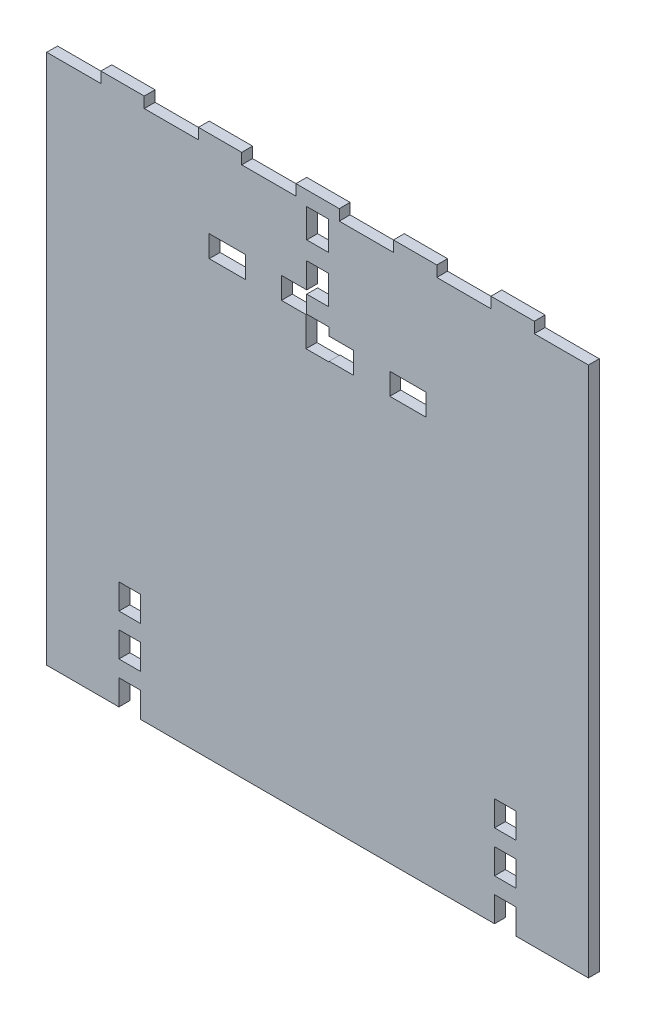
from build123d import *

# Parameters (mm, degrees)
ESQUISSE1_W              = 150
ESQUISSE1_H              = 150
BOSS_EXTRU_1_DEPTH       = 3
ESQUISSE12_W             = 6
ESQUISSE12_H             = 7
ENL_V_MAT_EXTRU_3_DEPTH  = 3
ESQUISSE14_W             = 15
ESQUISSE14_H             = 3
ENL_V_MAT_EXTRU_4_DEPTH  = 3
ESQUISSE15_W             = 10
ESQUISSE15_H             = 6
ESQUISSE15_W_2           = 6
ESQUISSE15_H_2           = 8
ESQUISSE15_W_3           = 7
ENL_V_MAT_EXTRU_9_DEPTH  = 10
ESQUISSE17_W             = 6.4
ESQUISSE17_H             = 8.4
ENL_V_MAT_EXTRU_12_DEPTH = 10


with BuildPart() as part:
    # Esquisse1 → Boss.-Extru.1 (new body)
    with BuildSketch(Plane.XY):
        with Locations((75, -75)):
            Rectangle(ESQUISSE1_W, ESQUISSE1_H)
    extrude(amount=BOSS_EXTRU_1_DEPTH)

    # Esquisse12 → Enlèv. mat.-Extru.3 (cut)
    with BuildSketch(Plane(origin=(0, 0, 0), x_dir=(-1, 0, 0), z_dir=(0, 0, -1))):
        with Locations((-127, -123.5)):
            Rectangle(ESQUISSE12_W, ESQUISSE12_H)
        with Locations((-127, -135)):
            Rectangle(ESQUISSE12_W, ESQUISSE12_H)
        with Locations((-127, -146.5)):
            Rectangle(ESQUISSE12_W, ESQUISSE12_H)
        with Locations((-23, -123.5)):
            Rectangle(ESQUISSE12_W, ESQUISSE12_H)
        with Locations((-23, -135)):
            Rectangle(ESQUISSE12_W, ESQUISSE12_H)
        with Locations((-23, -146.5)):
            Rectangle(ESQUISSE12_W, ESQUISSE12_H)
    extrude(amount=-ENL_V_MAT_EXTRU_3_DEPTH, mode=Mode.SUBTRACT)

    # Esquisse14 → Enlèv. mat.-Extru.4 (cut)
    with BuildSketch(Plane(origin=(0, 0, 0), x_dir=(-1, 0, 0), z_dir=(0, 0, -1))):
        with Locations((-142.5, -1.5)):
            Rectangle(ESQUISSE14_W, ESQUISSE14_H)
        with Locations((-115.5, -1.5)):
            Rectangle(ESQUISSE14_W, ESQUISSE14_H)
        with Locations((-88.5, -1.5)):
            Rectangle(ESQUISSE14_W, ESQUISSE14_H)
        with Locations((-61.5, -1.5)):
            Rectangle(ESQUISSE14_W, ESQUISSE14_H)
        with Locations((-34.5, -1.5)):
            Rectangle(ESQUISSE14_W, ESQUISSE14_H)
        with Locations((-7.5, -1.5)):
            Rectangle(ESQUISSE14_W, ESQUISSE14_H)
    extrude(amount=-ENL_V_MAT_EXTRU_4_DEPTH, mode=Mode.SUBTRACT)

    # Esquisse15 → Enlèv. mat.-Extru.9 (cut)
    with BuildSketch(Plane(origin=(0, 0, 0), x_dir=(-1, 0, 0), z_dir=(0, 0, -1))):
        with Locations((-50, -27)):
            Rectangle(ESQUISSE15_W, ESQUISSE15_H)
        Polygon((-78, -17), (-78, -25), (-72, -25), (-72, -30), (-65, -30), (-65, -24), (-72, -24), (-72, -17), align=None)
        with Locations((-75, -8)):
            Rectangle(ESQUISSE15_W_2, ESQUISSE15_H_2)
        with Locations((-81.5, -35)):
            Rectangle(ESQUISSE15_W_3, ESQUISSE15_H)
        with Locations((-100, -35)):
            Rectangle(ESQUISSE15_W, ESQUISSE15_H)
    extrude(amount=-ENL_V_MAT_EXTRU_9_DEPTH, mode=Mode.SUBTRACT)

    # Esquisse17 → Enlèv. mat.-Extru.12 (cut)
    with BuildSketch(Plane(origin=(0, 0, 0), x_dir=(-1, 0, 0), z_dir=(0, 0, -1))):
        with Locations((-75, -34)):
            Rectangle(ESQUISSE17_W, ESQUISSE17_H)
    extrude(amount=-ENL_V_MAT_EXTRU_12_DEPTH, mode=Mode.SUBTRACT)


solid = part.part
